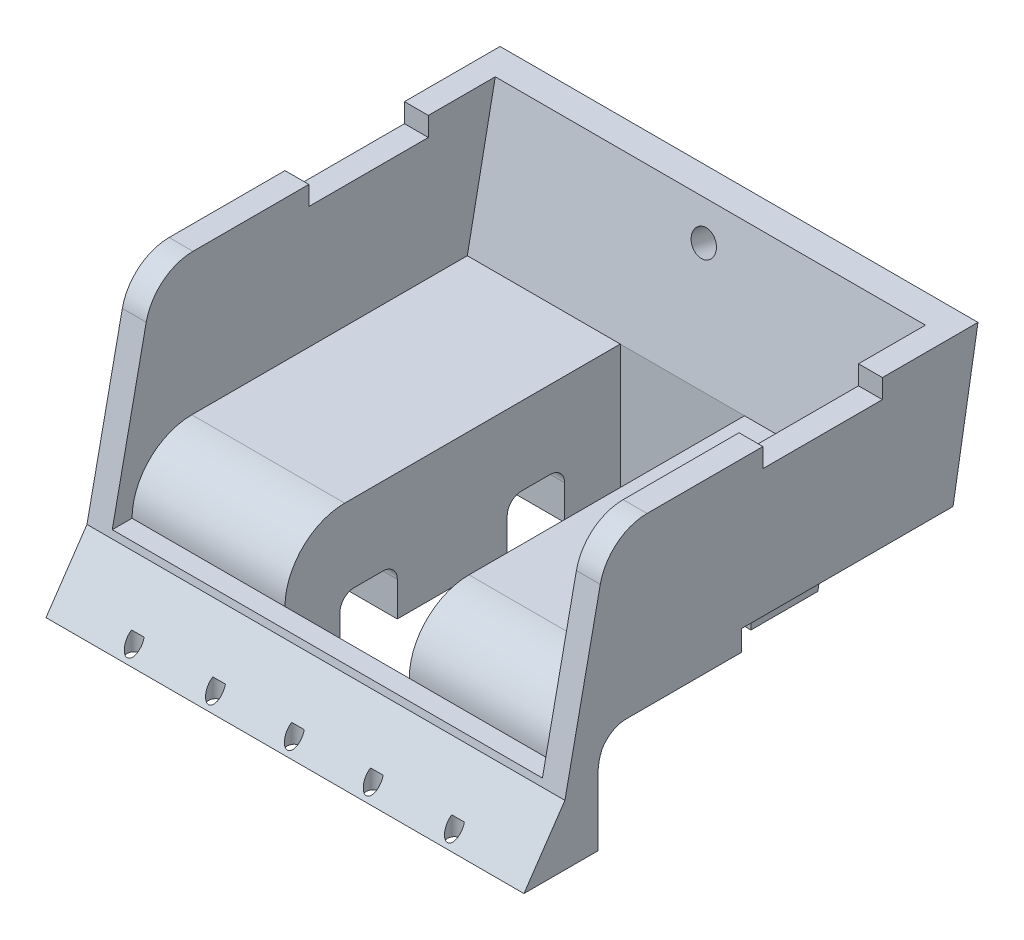
from build123d import *

# Parameters (mm, degrees)
SALIENTE_EXTRUIR1_DEPTH  = 100
CROQUIS4_W               = 90
CROQUIS4_H               = 70
CORTAR_EXTRUIR1_DEPTH    = 44
SALIENTE_EXTRUIR2_DEPTH  = 19
SALIENTE_EXTRUIR4_START  = 19
SALIENTE_EXTRUIR4_DEPTH  = 19
SALIENTE_EXTRUIR7_DEPTH  = 13
SALIENTE_EXTRUIR28_START = 13
CROQUIS11_W              = 34
CROQUIS11_H              = 2.5
SALIENTE_EXTRUIR28_DEPTH = 13
CROQUIS13_W              = 28
CROQUIS13_H              = 6
SALIENTE_EXTRUIR10_DEPTH = 24
CROQUIS15_R              = 1.5
CORTAR_EXTRUIR2_DEPTH    = 5
CORTAR_EXTRUIR3_DEPTH    = 24
SALIENTE_EXTRUIR12_START = -28
SALIENTE_EXTRUIR12_DEPTH = 28
SALIENTE_EXTRUIR13_DEPTH = 52
SALIENTE_EXTRUIR14_DEPTH = 100
CORTAR_EXTRUIR4_DEPTH    = 24
SALIENTE_EXTRUIR15_DEPTH = 24
CORTAR_EXTRUIR7_DEPTH    = 90
SALIENTE_EXTRUIR27_DEPTH = 14
CORTAR_EXTRUIR12_DEPTH   = 90
CROQUIS41_R              = 2.6
CORTAR_EXTRUIR13_DEPTH   = 10
CROQUIS42_W              = 26
CROQUIS42_H              = 3.651340431
CORTAR_EXTRUIR14_DEPTH   = 121.043742028
CROQUIS37_W              = 5
CROQUIS37_H              = 25
CORTAR_EXTRUIR15_DEPTH   = 4
CROQUIS44_R              = 1.5
CORTAR_EXTRUIR16_DEPTH   = 4


with BuildPart() as part:
    # Croquis1 → Saliente-Extruir1 (new body)
    with BuildSketch(Plane(origin=(0, 0, 0), x_dir=(0, 0, -1), z_dir=(1, 0, 0))):
        with BuildLine():
            Line((50, 24), (50, 56))
            Line((50, 56), (-1.5, 56))
            Line((-1.5, 56), (-9.741455248, 56))
            ThreePointArc((-9.741455248, 56), (-16.048737738, 53.76003786), (-19.530405432, 48.043637519))
            Line((-19.530405432, 48.043637519), (-26.9291309, 12.604008733))
            Line((-26.9291309, 12.604008733), (-35.5, 0))
            Line((-35.5, 0), (-20, 0))
            Line((-20, 0), (-20, 14))
            ThreePointArc((-20, 14), (-17.071067812, 21.071067812), (-10, 24))
            Line((-10, 24), (50, 24))
        make_face()
    extrude(amount=SALIENTE_EXTRUIR1_DEPTH)

    # Croquis4 → Cortar-Extruir1 (cut, symmetric)
    with BuildSketch(Plane.XY):
        with Locations((50, 35)):
            Rectangle(CROQUIS4_W, CROQUIS4_H)
    extrude(amount=CORTAR_EXTRUIR1_DEPTH, both=True, mode=Mode.SUBTRACT)

    # Croquis5 → Saliente-Extruir2 (add)
    with BuildSketch(Plane(origin=(5, 0, 0), x_dir=(0, 0, -1), z_dir=(1, 0, 0))):
        with BuildLine():
            Line((-20, 0), (-20, 14))
            ThreePointArc((-20, 14), (-17.071067812, 21.071067812), (-10, 24))
            Line((-10, 24), (50, 24))
            Line((50, 24), (50, 26.5))
            Line((50, 26.5), (-10, 26.5))
            ThreePointArc((-10, 26.5), (-18.838834765, 22.838834765), (-22.5, 14))
            Line((-22.5, 14), (-22.5, 0))
            Line((-22.5, 0), (-20, 0))
        make_face()
    extrude(amount=SALIENTE_EXTRUIR2_DEPTH)

    # Croquis7 → Saliente-Extruir4 (add)
    with BuildSketch(Plane.ZY.offset(-95).offset(SALIENTE_EXTRUIR4_START)):
        with BuildLine():
            Line((20, 14), (20, 0))
            Line((20, 0), (22.5, 0))
            Line((22.5, 0), (22.5, 14))
            ThreePointArc((22.5, 14), (18.838834765, 22.838834765), (10, 26.5))
            Line((10, 26.5), (-50, 26.5))
            Line((-50, 26.5), (-50, 24))
            Line((-50, 24), (10, 24))
            ThreePointArc((10, 24), (17.071067812, 21.071067812), (20, 14))
        make_face()
    extrude(amount=-SALIENTE_EXTRUIR4_DEPTH)

    # Croquis10 → Saliente-Extruir7 (add)
    with BuildSketch(Plane(origin=(24, 0, 0), x_dir=(0, 0, -1), z_dir=(1, 0, 0))):
        with BuildLine():
            Line((50, 26.5), (-10, 26.5))
            ThreePointArc((-10, 26.5), (-18.838834765, 22.838834765), (-22.5, 14))
            Line((-22.5, 14), (-22.5, 0))
            Line((-22.5, 0), (-11, 0))
            Line((-11, 0), (-11, 7.2))
            ThreePointArc((-11, 7.2), (-10.121320344, 9.321320344), (-8, 10.2))
            Line((-8, 10.2), (-2, 10.2))
            ThreePointArc((-2, 10.2), (0.121320344, 9.321320344), (1, 7.2))
            Line((1, 7.2), (1, 0))
            Line((1, 0), (24, 0))
            Line((24, 0), (24, 7.2))
            ThreePointArc((24, 7.2), (24.878679656, 9.321320344), (27, 10.2))
            Line((27, 10.2), (33, 10.2))
            ThreePointArc((33, 10.2), (35.121320344, 9.321320344), (36, 7.2))
            Line((36, 7.2), (36, 0))
            Line((36, 0), (50, 0))
            Line((50, 0), (50, 26.5))
        make_face()
    extrude(amount=SALIENTE_EXTRUIR7_DEPTH)

    # Croquis11 → Saliente-Extruir28 (add)
    with BuildSketch(Plane.ZY.offset(-76).offset(SALIENTE_EXTRUIR28_START)):
        with BuildLine():
            Line((10, 24), (-10, 24))
            Line((-10, 24), (-10, 0))
            Line((-10, 0), (-1, 0))
            Line((-1, 0), (-1, 7.2))
            ThreePointArc((-1, 7.2), (-0.121320344, 9.321320344), (2, 10.2))
            Line((2, 10.2), (8, 10.2))
            ThreePointArc((8, 10.2), (10.121320344, 9.321320344), (11, 7.2))
            Line((11, 7.2), (11, 0))
            Line((11, 0), (20, 0))
            Line((20, 0), (20, 14))
            ThreePointArc((20, 14), (17.071067812, 21.071067812), (10, 24))
        make_face()
        with BuildLine():
            Line((-10, 0), (-10, 24))
            Line((-10, 24), (-44, 24))
            Line((-44, 24), (-44, 26.5))
            Line((-44, 26.5), (-50, 26.5))
            Line((-50, 26.5), (-50, 24))
            Line((-50, 24), (-50, 0))
            Line((-50, 0), (-36, 0))
            Line((-36, 0), (-36, 7.2))
            ThreePointArc((-36, 7.2), (-35.121320344, 9.321320344), (-33, 10.2))
            Line((-33, 10.2), (-27, 10.2))
            ThreePointArc((-27, 10.2), (-24.878679656, 9.321320344), (-24, 7.2))
            Line((-24, 7.2), (-24, 0))
            Line((-24, 0), (-10, 0))
        make_face()
        with Locations((-27, 25.25)):
            Rectangle(CROQUIS11_W, CROQUIS11_H)
        with BuildLine():
            Line((10, 26.5), (-10, 26.5))
            Line((-10, 26.5), (-10, 24))
            Line((-10, 24), (10, 24))
            ThreePointArc((10, 24), (17.071067812, 21.071067812), (20, 14))
            Line((20, 14), (20, 0))
            Line((20, 0), (22.5, 0))
            Line((22.5, 0), (22.5, 14))
            ThreePointArc((22.5, 14), (18.838834765, 22.838834765), (10, 26.5))
        make_face()
    extrude(amount=-SALIENTE_EXTRUIR28_DEPTH)

    # Croquis13 → Saliente-Extruir10 (add)
    with BuildSketch(Plane.XZ.offset(-24)):
        with Locations((50, -47)):
            Rectangle(CROQUIS13_W, CROQUIS13_H)
    extrude(amount=SALIENTE_EXTRUIR10_DEPTH)

    # Croquis15 → Cortar-Extruir2 (cut)
    with BuildSketch(Plane(origin=(0, 0, 0), x_dir=(1, 0, 0), z_dir=(0, 1, 0))):
        with Locations(Location((70, 38.5, 0), (0, 0, 270))):
            Circle(CROQUIS15_R)
        with Locations(Location((70, 8.5, 0), (0, 0, 270))):
            Circle(CROQUIS15_R)
        with Locations(Location((70, -18.5, 0), (0, 0, 270))):
            Circle(CROQUIS15_R)
        with Locations(Location((29, -18.5, 0), (0, 0, 90))):
            Circle(CROQUIS15_R)
        with Locations(Location((29, 8.5, 0), (0, 0, 90))):
            Circle(CROQUIS15_R)
        with Locations(Location((29, 38.5, 0), (0, 0, 90))):
            Circle(CROQUIS15_R)
    extrude(amount=CORTAR_EXTRUIR2_DEPTH, mode=Mode.SUBTRACT)

    # Croquis16 → Cortar-Extruir3 (cut)
    with BuildSketch(Plane(origin=(100, 0, 0), x_dir=(0, 0, -1), z_dir=(1, 0, 0))):
        with BuildLine():
            Line((10, 24.25), (10, 24))
            Line((10, 24), (50, 24))
            Line((50, 24), (50.733673202, 24))
            Line((50.733673202, 24), (50.733673202, 28.25))
            Line((50.733673202, 28.25), (50, 28.25))
            Line((50, 28.25), (50, 27.25))
            ThreePointArc((50, 27.25), (49.414213562, 25.835786438), (48, 25.25))
            Line((48, 25.25), (11, 25.25))
            Line((11, 25.25), (10, 25.25))
            Line((10, 25.25), (10, 24.25))
        make_face()
    extrude(amount=-CORTAR_EXTRUIR3_DEPTH, mode=Mode.SUBTRACT)

    # Croquis17 → Saliente-Extruir12 (add)
    with BuildSketch(Plane(origin=(100, 0, 0), x_dir=(0, 0, -1), z_dir=(1, 0, 0)).offset(SALIENTE_EXTRUIR12_START)):
        with BuildLine():
            Line((-14, 20.944171176), (7, 20.944171176))
            Line((7, 20.944171176), (10, 20.944171176))
            Line((10, 20.944171176), (10, 23.944171176))
            Line((10, 23.944171176), (10, 24))
            Line((10, 24), (10, 26.5))
            Line((10, 26.5), (-10, 26.5))
            ThreePointArc((-10, 26.5), (-18.838834765, 22.838834765), (-22.5, 14))
            Line((-22.5, 14), (-20, 14))
            Line((-20, 14), (-20, 14.944171176))
            ThreePointArc((-20, 14.944171176), (-18.242640687, 19.186811864), (-14, 20.944171176))
        make_face()
    extrude(amount=SALIENTE_EXTRUIR12_DEPTH)

    # Croquis18 → Saliente-Extruir13 (add)
    with BuildSketch(Plane(origin=(76, 0, 0), x_dir=(0, 0, -1), z_dir=(1, 0, 0))):
        Polygon((50, 0), (50, 56), (59.5, 56), align=None)
    extrude(amount=-SALIENTE_EXTRUIR13_DEPTH)

    # Croquis19 → Saliente-Extruir14 (add)
    with BuildSketch(Plane(origin=(100, 0, 0), x_dir=(0, 0, -1), z_dir=(1, 0, 0))):
        with BuildLine():
            Line((48, 25.25), (54.283482143, 25.25))
            Line((54.283482143, 25.25), (59.5, 56))
            Line((59.5, 56), (50, 56))
            Line((50, 56), (50, 27.25))
            ThreePointArc((50, 27.25), (49.414213562, 25.835786438), (48, 25.25))
        make_face()
    extrude(amount=-SALIENTE_EXTRUIR14_DEPTH)

    # Croquis20 → Cortar-Extruir4 (cut)
    with BuildSketch(Plane.ZY):
        Polygon((-48, 25.25), (-50.733673202, 25.25), (-50.733673202, 24), (-50, 24), (-10, 24), (-10, 24.25), (-10, 25.25), (-11, 25.25), align=None)
    extrude(amount=-CORTAR_EXTRUIR4_DEPTH, mode=Mode.SUBTRACT)

    # Croquis21 → Saliente-Extruir15 (add)
    with BuildSketch(Plane.ZY):
        with BuildLine():
            Line((20, 14.944171176), (20, 14))
            Line((20, 14), (22.5, 14))
            ThreePointArc((22.5, 14), (18.838834765, 22.838834765), (10, 26.5))
            Line((10, 26.5), (-10, 26.5))
            Line((-10, 26.5), (-10, 24))
            Line((-10, 24), (-10, 23.944171176))
            Line((-10, 23.944171176), (-10, 20.944171176))
            Line((-10, 20.944171176), (-7, 20.944171176))
            Line((-7, 20.944171176), (14, 20.944171176))
            ThreePointArc((14, 20.944171176), (18.242640687, 19.186811864), (20, 14.944171176))
        make_face()
    extrude(amount=-SALIENTE_EXTRUIR15_DEPTH)

    # Croquis23 → Cortar-Extruir7 (cut)
    with BuildSketch(Plane(origin=(5, 0, 0), x_dir=(0, 0, -1), z_dir=(1, 0, 0))):
        Polygon((44, 56), (53.5, 56), (47.651340431, 26.5), (44, 26.5), align=None)
    extrude(amount=CORTAR_EXTRUIR7_DEPTH, mode=Mode.SUBTRACT)

    # Croquis39 → Saliente-Extruir27 (add)
    with BuildSketch(Plane(origin=(0, 0, 0), x_dir=(1, 0, 0), z_dir=(0, 1, 0))):
        Polygon((5, -26.5), (5, -35.5), (95, -35.5), (95, -26.5), (95, -22.5), (5, -22.5), align=None)
    extrude(amount=SALIENTE_EXTRUIR27_DEPTH)

    # Croquis40 → Cortar-Extruir12 (cut)
    with BuildSketch(Plane(origin=(95, 0, 0), x_dir=(0, 0, -1), z_dir=(1, 0, 0))):
        Polygon((-26.637690033, 14), (-35.5, 14), (-35.5, 0), (-26.9291309, 12.604008733), align=None)
    extrude(amount=-CORTAR_EXTRUIR12_DEPTH, mode=Mode.SUBTRACT)

    # Croquis41 → Cortar-Extruir13 (cut)
    with BuildSketch(Plane(origin=(0, -8.087799177, -40.793975597), x_dir=(1, 0, 0), z_dir=(0, 0.19447439298800823, 0.9809075952769181))):
        with Locations(Location((50, 58.257848261, 0), (0, 0, 270))):
            Circle(CROQUIS41_R)
    extrude(amount=-CORTAR_EXTRUIR13_DEPTH, mode=Mode.SUBTRACT)

    # Croquis42 → Cortar-Extruir14 (cut, through all)
    with BuildSketch(Plane(origin=(0, 26.5, 0), x_dir=(1, 0, 0), z_dir=(0, 1, 0))):
        with Locations((50, 45.825670215)):
            Rectangle(CROQUIS42_W, CROQUIS42_H)
    extrude(amount=-CORTAR_EXTRUIR14_DEPTH, mode=Mode.SUBTRACT)

    # Croquis37 → Cortar-Extruir15 (cut)
    with BuildSketch(Plane(origin=(0, 56, 0), x_dir=(1, 0, 0), z_dir=(0, 1, 0))):
        with Locations((97.5, 27)):
            Rectangle(CROQUIS37_W, CROQUIS37_H)
        with Locations((2.5, 27)):
            Rectangle(CROQUIS37_W, CROQUIS37_H)
    extrude(amount=-CORTAR_EXTRUIR15_DEPTH, mode=Mode.SUBTRACT)

    # Croquis44 → Cortar-Extruir16 (cut)
    with BuildSketch(Plane.XZ):
        with Locations(Location((50, 33.5, 0), (0, 0, 270))):
            Circle(CROQUIS44_R)
        with Locations(Location((33.5, 33.5, 0), (0, 0, 270))):
            Circle(CROQUIS44_R)
        with Locations(Location((16.5, 33.5, 0), (0, 0, 270))):
            Circle(CROQUIS44_R)
        with Locations(Location((83.5, 33.5, 0), (0, 0, 331.312619738))):
            Circle(CROQUIS44_R)
        with Locations(Location((66.5, 33.5, 0), (0, 0, 331.312619738))):
            Circle(CROQUIS44_R)
    extrude(amount=-CORTAR_EXTRUIR16_DEPTH, mode=Mode.SUBTRACT)


solid = part.part
